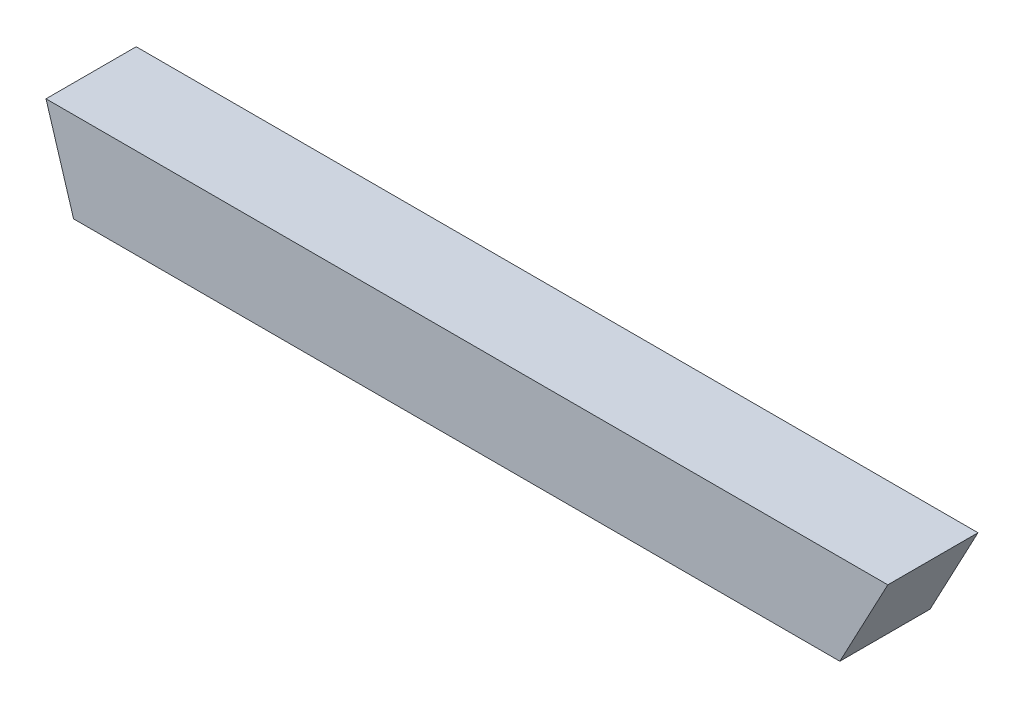
from build123d import *

# Parameters (mm, degrees)
BOSS_EXTRUDE2_DEPTH = 19.05


with BuildPart() as part:
    # Sketch1 → Boss-Extrude2 (new body)
    with BuildSketch(Plane.XY):
        Polygon((-51.831780581, 19.05), (-48.91969584, 9.525), (120.903687082, 9.525), (125.968219419, 19.05), align=None)
        Polygon((-48.91969584, 9.525), (-46.0076111, 0), (115.839154746, 0), (120.903687082, 9.525), align=None)
    extrude(amount=BOSS_EXTRUDE2_DEPTH)


solid = part.part
